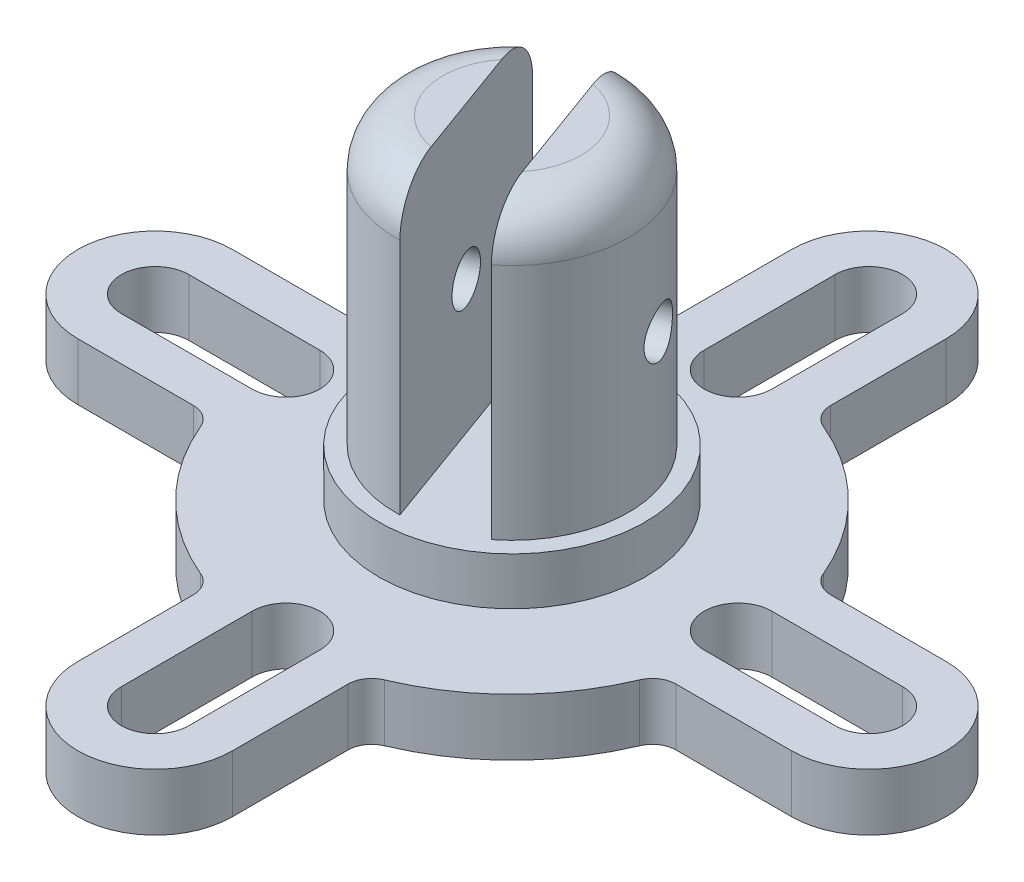
from build123d import *

# Parameters (mm, degrees)
BOSS_EXTRUDE1_DEPTH     = 2.4
FILLET1_R               = 1
CUT_EXTRUDE1_REACH      = 32.579
CUT_EXTRUDE2_DEPTH      = 32.741278757
CUT_EXTRUDE2_DEPTH_BACK = 32.741278757
SKETCH6_R               = 1


with BuildPart() as part:
    # Sketch1 → Boss-Extrude1 (new body)
    with BuildSketch(Plane(origin=(0, 0, 0), x_dir=(1, 0, 0), z_dir=(0, 1, 0))):
        with BuildLine():
            Line((-15, 3.25), (-9.45714016, 3.25))
            ThreePointArc((-9.45714016, 3.25), (-7.071067812, 7.071067812), (-3.25, 9.45714016))
            Line((-3.25, 9.45714016), (-3.25, 15))
            ThreePointArc((-3.25, 15), (0, 18.25), (3.25, 15))
            Line((3.25, 15), (3.25, 9.45714016))
            ThreePointArc((3.25, 9.45714016), (7.071067812, 7.071067812), (9.45714016, 3.25))
            Line((9.45714016, 3.25), (15, 3.25))
            ThreePointArc((15, 3.25), (18.25, 0), (15, -3.25))
            Line((15, -3.25), (9.45714016, -3.25))
            ThreePointArc((9.45714016, -3.25), (7.071067812, -7.071067812), (3.25, -9.45714016))
            Line((3.25, -9.45714016), (3.25, -15))
            ThreePointArc((3.25, -15), (0, -18.25), (-3.25, -15))
            Line((-3.25, -15), (-3.25, -9.45714016))
            ThreePointArc((-3.25, -9.45714016), (-7.071067812, -7.071067812), (-9.45714016, -3.25))
            Line((-9.45714016, -3.25), (-15, -3.25))
            ThreePointArc((-15, -3.25), (-18.25, 0), (-15, 3.25))
        make_face()
        with BuildLine():
            Line((-15, 1.42), (-9.5, 1.42))
            ThreePointArc((-9.5, 1.42), (-8.08, 0), (-9.5, -1.42))
            Line((-9.5, -1.42), (-15, -1.42))
            ThreePointArc((-15, -1.42), (-16.42, 0), (-15, 1.42))
        make_face(mode=Mode.SUBTRACT)
        with BuildLine():
            Line((1.42, 15), (1.42, 9.5))
            ThreePointArc((1.42, 9.5), (0, 8.08), (-1.42, 9.5))
            Line((-1.42, 9.5), (-1.42, 15))
            ThreePointArc((-1.42, 15), (0, 16.42), (1.42, 15))
        make_face(mode=Mode.SUBTRACT)
        with BuildLine():
            Line((15, -1.42), (9.5, -1.42))
            ThreePointArc((9.5, -1.42), (8.08, 0), (9.5, 1.42))
            Line((9.5, 1.42), (15, 1.42))
            ThreePointArc((15, 1.42), (16.42, 0), (15, -1.42))
        make_face(mode=Mode.SUBTRACT)
        with BuildLine():
            Line((-1.42, -15), (-1.42, -9.5))
            ThreePointArc((-1.42, -9.5), (0, -8.08), (1.42, -9.5))
            Line((1.42, -9.5), (1.42, -15))
            ThreePointArc((1.42, -15), (0, -16.42), (-1.42, -15))
        make_face(mode=Mode.SUBTRACT)
    extrude(amount=BOSS_EXTRUDE1_DEPTH)

    # Fillet1
    fillet1_edges = [part.edges().sort_by_distance(p)[0] for p in [
        (-9.45714016, 1.2, -3.25),
        (-3.25, 1.2, -9.45714016),
        (3.25, 1.2, -9.45714016),
        (9.45714016, 1.2, -3.25),
        (9.45714016, 1.2, 3.25),
        (3.25, 1.2, 9.45714016),
        (-3.25, 1.2, 9.45714016),
        (-9.45714016, 1.2, 3.25),
    ]]
    fillet(fillet1_edges, radius=FILLET1_R)

    # Sketch2 → Revolve2 (revolve)
    with BuildSketch(Plane.XY, mode=Mode.PRIVATE) as revolve2_sk:
        with BuildLine():
            Line((0, 4.4), (0, 16.4))
            Line((0, 16.4), (2.9, 16.4))
            ThreePointArc((2.9, 16.4), (4.314213562, 15.814213562), (4.9, 14.4))
            Line((4.9, 14.4), (4.9, 4.4))
            Line((4.9, 4.4), (5.6, 4.4))
            Line((5.6, 4.4), (5.6, 2.4))
            Line((5.6, 2.4), (0, 2.4))
            Line((0, 2.4), (0, 4.4))
        make_face()
    revolve(revolve2_sk.sketch.rotate(Axis((0, 4.4, 0), (0, 1, 0)), 90), axis=Axis((0, 4.4, 0), (0, 1, 0)))

    # Cut-Extrude1: up to this face of the body (flat: up to its plane)
    cut_extrude1_end = Plane(part.part.faces().sort_by_distance((0, 4.4, 5.058391919))[0])
    # Sketch5 → Cut-Extrude1 (cut, up to the picked face)
    with BuildSketch(Plane(origin=(0, 16.4, 0), x_dir=(1, 0, 0), z_dir=(0, 1, 0)), mode=Mode.PRIVATE) as cut_extrude1_sk1:
        with BuildLine():
            ThreePointArc((-0.560667259, -2.845285965), (0.991858416, -2.7251086), (2.258410603, -1.819225535))
            Line((2.258410603, -1.819225535), (0.560667259, 2.845285965))
            ThreePointArc((0.560667259, 2.845285965), (-0.991858416, 2.7251086), (-2.258410603, 1.819225535))
            Line((-2.258410603, 1.819225535), (-0.560667259, -2.845285965))
        make_face()
    cut_extrude1_tool1 = split(extrude(cut_extrude1_sk1.sketch, amount=-CUT_EXTRUDE1_REACH, mode=Mode.PRIVATE), bisect_by=cut_extrude1_end, keep=Keep.BOTH, mode=Mode.PRIVATE)
    # Sketch5 → Cut-Extrude1 (cut, up to the picked face)
    with BuildSketch(Plane(origin=(0, 16.4, 0), x_dir=(1, 0, 0), z_dir=(0, 1, 0)), mode=Mode.PRIVATE) as cut_extrude1_sk2:
        with BuildLine():
            ThreePointArc((0.185903471, -4.896472189), (1.675898702, -4.604493842), (3.004981333, -3.870411759))
            Line((3.004981333, -3.870411759), (2.258410603, -1.819225535))
            ThreePointArc((2.258410603, -1.819225535), (0.991858416, -2.7251086), (-0.560667259, -2.845285965))
            Line((-0.560667259, -2.845285965), (0.185903471, -4.896472189))
        make_face()
    cut_extrude1_tool2 = split(extrude(cut_extrude1_sk2.sketch, amount=-CUT_EXTRUDE1_REACH, mode=Mode.PRIVATE), bisect_by=cut_extrude1_end, keep=Keep.BOTH, mode=Mode.PRIVATE)
    # Sketch5 → Cut-Extrude1 (cut, up to the picked face)
    with BuildSketch(Plane(origin=(0, 16.4, 0), x_dir=(1, 0, 0), z_dir=(0, 1, 0)), mode=Mode.PRIVATE) as cut_extrude1_sk3:
        with BuildLine():
            ThreePointArc((-2.258410603, 1.819225535), (-0.991858416, 2.7251086), (0.560667259, 2.845285965))
            Line((0.560667259, 2.845285965), (-0.185903471, 4.896472189))
            ThreePointArc((-0.185903471, 4.896472189), (-1.675898702, 4.604493842), (-3.004981333, 3.870411759))
            Line((-3.004981333, 3.870411759), (-2.258410603, 1.819225535))
        make_face()
    cut_extrude1_tool3 = split(extrude(cut_extrude1_sk3.sketch, amount=-CUT_EXTRUDE1_REACH, mode=Mode.PRIVATE), bisect_by=cut_extrude1_end, keep=Keep.BOTH, mode=Mode.PRIVATE)
    add(cut_extrude1_tool1.solids().sort_by(Axis((0, 16.4, 0), (0, -1, 0)))[0], mode=Mode.SUBTRACT)
    add(cut_extrude1_tool2.solids().sort_by(Axis((1.296647, 16.4, 3.562508), (0, -1, 0)))[0], mode=Mode.SUBTRACT)
    add(cut_extrude1_tool3.solids().sort_by(Axis((-1.296647, 16.4, -3.562508), (0, -1, 0)))[0], mode=Mode.SUBTRACT)

    # Sketch6 → Cut-Extrude2 (cut, two sides: drawn at the far end of the back side and taken through both)
    with BuildSketch(Plane(origin=(1.409538931, 0, -0.513030215), x_dir=(0.3420201433256665, 0, 0.9396926207859093), z_dir=(-0.9396926207859092, 0, 0.34202014332566644)).offset(-CUT_EXTRUDE2_DEPTH_BACK)):
        with Locations((0, 10)):
            Circle(SKETCH6_R)
    extrude(amount=CUT_EXTRUDE2_DEPTH + CUT_EXTRUDE2_DEPTH_BACK, mode=Mode.SUBTRACT)


solid = part.part
